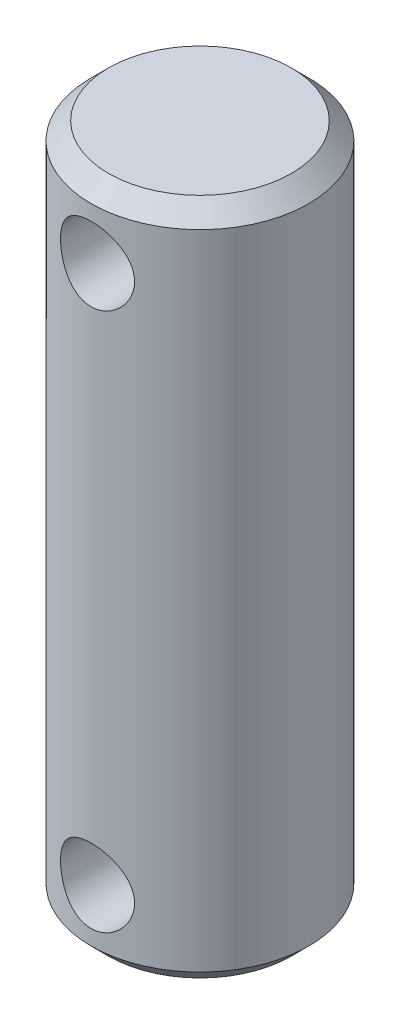
from build123d import *

# Parameters (mm, degrees)
ESBO_O1_R                = 12.5
RESSALTO_EXTRUS_O1_DEPTH = 38.91
CHANFRO1_SIZE            = 2
ESBO_O2_R                = 4.25
CORTE_EXTRUS_O1_DEPTH    = 43


with BuildPart() as part:
    # Esboço1 → Ressalto-extrusão1 (new, symmetric)
    with BuildSketch(Plane(origin=(0, 0, 0), x_dir=(1, 0, 0), z_dir=(0, 1, 0))):
        with Locations(Location((0, 0, 0), (0, 0, 270))):
            Circle(ESBO_O1_R)
    extrude(amount=RESSALTO_EXTRUS_O1_DEPTH, both=True)

    # Chanfro1
    chanfro1_edges = [part.edges().sort_by_distance(p)[0] for p in [
        (0, -38.91, -12.5),
        (0, 38.91, -12.5),
    ]]
    chamfer(chanfro1_edges, length=CHANFRO1_SIZE)

    # Esboço2 → Corte-extrusão1 (cut, symmetric)
    with BuildSketch(Plane.XY):
        with Locations(Location((0, 30.91, 0), (0, 0, 89.999999985))):
            Circle(ESBO_O2_R)
        with Locations(Location((0, -30.91, 0), (0, 0, 89.999999985))):
            Circle(ESBO_O2_R)
    extrude(amount=CORTE_EXTRUS_O1_DEPTH, both=True, mode=Mode.SUBTRACT)


solid = part.part
